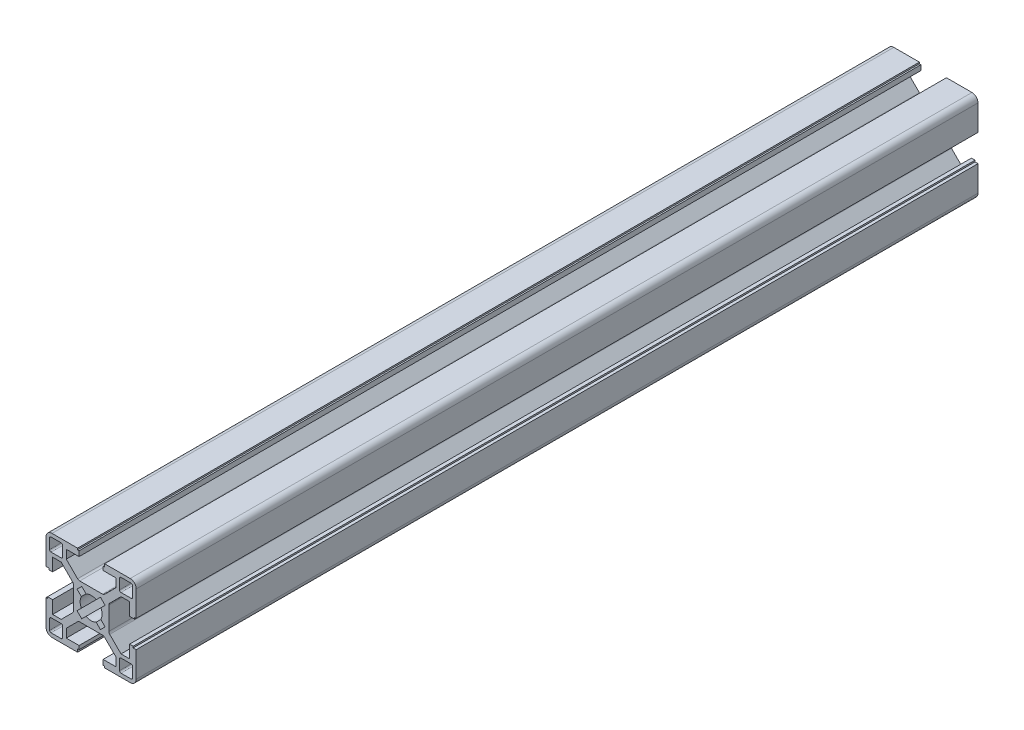
from build123d import *

# Parameters (mm, degrees)
BOSS_EXTRUDE1_DEPTH = 280


with BuildPart() as part:
    # Sketch1 → Boss-Extrude1 (new body)
    with BuildSketch(Plane.XY):
        with BuildLine():
            Line((-4.5, 14.5), (-4.5, 15))
            Line((-4.5, 15), (-13, 15))
            ThreePointArc((-13, 15), (-14.414213562, 14.414213562), (-15, 13))
            Line((-15, 13), (-15, 4.5))
            Line((-15, 4.5), (-14, 4.5))
            Line((-14, 4.5), (-14, 4))
            Line((-14, 4), (-12.8, 4))
            Line((-12.8, 4), (-12.8, 8.25))
            Line((-12.8, 8.25), (-9.95, 8.25))
            Line((-9.95, 8.25), (-6.192893219, 4.492893219))
            ThreePointArc((-6.192893219, 4.492893219), (-5.976120467, 4.16846987), (-5.9, 3.785786438))
            Line((-5.9, 3.785786438), (-5.9, -3.785786438))
            ThreePointArc((-5.9, -3.785786438), (-5.976120467, -4.16846987), (-6.192893219, -4.492893219))
            Line((-6.192893219, -4.492893219), (-9.95, -8.25))
            Line((-9.95, -8.25), (-12.8, -8.25))
            Line((-12.8, -8.25), (-12.8, -4))
            Line((-12.8, -4), (-14.5, -4))
            Line((-14.5, -4), (-14.5, -4.5))
            Line((-14.5, -4.5), (-15, -4.5))
            Line((-15, -4.5), (-15, -13))
            ThreePointArc((-15, -13), (-14.414213562, -14.414213562), (-13, -15))
            Line((-13, -15), (-4.5, -15))
            Line((-4.5, -15), (-4.5, -14))
            Line((-4.5, -14), (-4, -14))
            Line((-4, -14), (-4, -12.8))
            Line((-4, -12.8), (-8.25, -12.8))
            Line((-8.25, -12.8), (-8.25, -9.95))
            Line((-8.25, -9.95), (-4.492893219, -6.192893219))
            ThreePointArc((-4.492893219, -6.192893219), (-4.16846987, -5.976120467), (-3.785786438, -5.9))
            Line((-3.785786438, -5.9), (3.785786438, -5.9))
            ThreePointArc((3.785786438, -5.9), (4.16846987, -5.976120467), (4.492893219, -6.192893219))
            Line((4.492893219, -6.192893219), (8.25, -9.95))
            Line((8.25, -9.95), (8.25, -12.8))
            Line((8.25, -12.8), (4, -12.8))
            Line((4, -12.8), (4, -14.5))
            Line((4, -14.5), (4.5, -14.5))
            Line((4.5, -14.5), (4.5, -15))
            Line((4.5, -15), (13, -15))
            ThreePointArc((13, -15), (14.414213562, -14.414213562), (15, -13))
            Line((15, -13), (15, -4.5))
            Line((15, -4.5), (14, -4.5))
            Line((14, -4.5), (14, -4))
            Line((14, -4), (12.8, -4))
            Line((12.8, -4), (12.8, -8.25))
            Line((12.8, -8.25), (9.95, -8.25))
            Line((9.95, -8.25), (6.192893219, -4.492893219))
            ThreePointArc((6.192893219, -4.492893219), (5.976120467, -4.16846987), (5.9, -3.785786438))
            Line((5.9, -3.785786438), (5.9, 3.785786438))
            ThreePointArc((5.9, 3.785786438), (5.976120467, 4.16846987), (6.192893219, 4.492893219))
            Line((6.192893219, 4.492893219), (9.95, 8.25))
            Line((9.95, 8.25), (12.8, 8.25))
            Line((12.8, 8.25), (12.8, 4))
            Line((12.8, 4), (14.5, 4))
            Line((14.5, 4), (14.5, 4.5))
            Line((14.5, 4.5), (15, 4.5))
            Line((15, 4.5), (15, 13))
            ThreePointArc((15, 13), (14.414213562, 14.414213562), (13, 15))
            Line((13, 15), (4.5, 15))
            Line((4.5, 15), (4.5, 14))
            Line((4.5, 14), (4, 14))
            Line((4, 14), (4, 12.8))
            Line((4, 12.8), (8.25, 12.8))
            Line((8.25, 12.8), (8.25, 9.95))
            Line((8.25, 9.95), (4.492893219, 6.192893219))
            ThreePointArc((4.492893219, 6.192893219), (4.16846987, 5.976120467), (3.785786438, 5.9))
            Line((3.785786438, 5.9), (-3.785786438, 5.9))
            ThreePointArc((-3.785786438, 5.9), (-4.16846987, 5.976120467), (-4.492893219, 6.192893219))
            Line((-4.492893219, 6.192893219), (-8.25, 9.95))
            Line((-8.25, 9.95), (-8.25, 12.8))
            Line((-8.25, 12.8), (-4, 12.8))
            Line((-4, 12.8), (-4, 14.5))
            Line((-4, 14.5), (-4.5, 14.5))
        make_face()
        with BuildLine():
            Line((-9.45, -9.95), (-9.45, -13.3))
            ThreePointArc((-9.45, -13.3), (-9.596446609, -13.653553391), (-9.95, -13.8))
            Line((-9.95, -13.8), (-13.3, -13.8))
            ThreePointArc((-13.3, -13.8), (-13.653553391, -13.653553391), (-13.8, -13.3))
            Line((-13.8, -13.3), (-13.8, -9.95))
            ThreePointArc((-13.8, -9.95), (-13.653553391, -9.596446609), (-13.3, -9.45))
            Line((-13.3, -9.45), (-9.95, -9.45))
            ThreePointArc((-9.95, -9.45), (-9.596446609, -9.596446609), (-9.45, -9.95))
        make_face(mode=Mode.SUBTRACT)
        with BuildLine():
            Line((9.95, -9.45), (13.3, -9.45))
            ThreePointArc((13.3, -9.45), (13.653553391, -9.596446609), (13.8, -9.95))
            Line((13.8, -9.95), (13.8, -13.3))
            ThreePointArc((13.8, -13.3), (13.653553391, -13.653553391), (13.3, -13.8))
            Line((13.3, -13.8), (9.95, -13.8))
            ThreePointArc((9.95, -13.8), (9.596446609, -13.653553391), (9.45, -13.3))
            Line((9.45, -13.3), (9.45, -9.95))
            ThreePointArc((9.45, -9.95), (9.596446609, -9.596446609), (9.95, -9.45))
        make_face(mode=Mode.SUBTRACT)
        with BuildLine():
            Line((-9.95, 9.45), (-13.3, 9.45))
            ThreePointArc((-13.3, 9.45), (-13.653553391, 9.596446609), (-13.8, 9.95))
            Line((-13.8, 9.95), (-13.8, 13.3))
            ThreePointArc((-13.8, 13.3), (-13.653553391, 13.653553391), (-13.3, 13.8))
            Line((-13.3, 13.8), (-9.95, 13.8))
            ThreePointArc((-9.95, 13.8), (-9.596446609, 13.653553391), (-9.45, 13.3))
            Line((-9.45, 13.3), (-9.45, 9.95))
            ThreePointArc((-9.45, 9.95), (-9.596446609, 9.596446609), (-9.95, 9.45))
        make_face(mode=Mode.SUBTRACT)
        with BuildLine():
            ThreePointArc((1.683127481, -3.2387624), (0, -3.65), (-1.683127481, -3.2387624))
            Line((-1.683127481, -3.2387624), (-3.111269837, -4.666904756))
            Line((-3.111269837, -4.666904756), (-4.666904756, -3.111269837))
            Line((-4.666904756, -3.111269837), (-3.2387624, -1.683127481))
            ThreePointArc((-3.2387624, -1.683127481), (-3.65, 0), (-3.2387624, 1.683127481))
            Line((-3.2387624, 1.683127481), (-4.666904756, 3.111269837))
            Line((-4.666904756, 3.111269837), (-3.111269837, 4.666904756))
            Line((-3.111269837, 4.666904756), (-1.683127481, 3.2387624))
            ThreePointArc((-1.683127481, 3.2387624), (0, 3.65), (1.683127481, 3.2387624))
            Line((1.683127481, 3.2387624), (3.111269837, 4.666904756))
            Line((3.111269837, 4.666904756), (4.666904756, 3.111269837))
            Line((4.666904756, 3.111269837), (3.2387624, 1.683127481))
            ThreePointArc((3.2387624, 1.683127481), (3.65, 0), (3.2387624, -1.683127481))
            Line((3.2387624, -1.683127481), (4.666904756, -3.111269837))
            Line((4.666904756, -3.111269837), (3.111269837, -4.666904756))
            Line((3.111269837, -4.666904756), (1.683127481, -3.2387624))
        make_face(mode=Mode.SUBTRACT)
        with BuildLine():
            ThreePointArc((9.45, 13.3), (9.596446609, 13.653553391), (9.95, 13.8))
            Line((9.95, 13.8), (13.3, 13.8))
            ThreePointArc((13.3, 13.8), (13.653553391, 13.653553391), (13.8, 13.3))
            Line((13.8, 13.3), (13.8, 9.95))
            ThreePointArc((13.8, 9.95), (13.653553391, 9.596446609), (13.3, 9.45))
            Line((13.3, 9.45), (9.95, 9.45))
            ThreePointArc((9.95, 9.45), (9.596446609, 9.596446609), (9.45, 9.95))
            Line((9.45, 9.95), (9.45, 13.3))
        make_face(mode=Mode.SUBTRACT)
    extrude(amount=BOSS_EXTRUDE1_DEPTH)


solid = part.part
